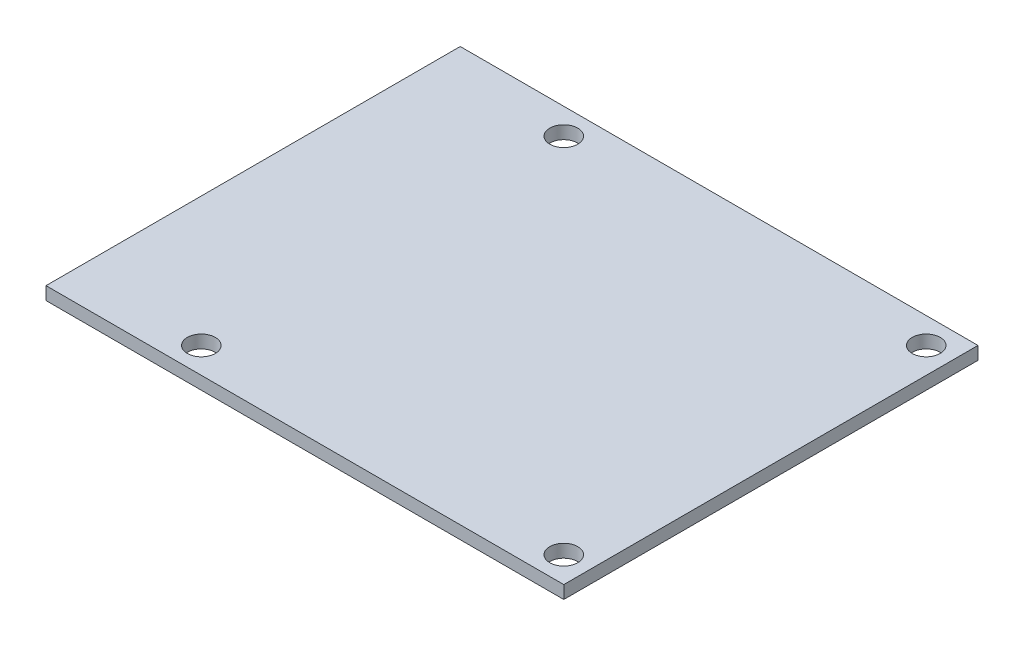
from build123d import *

# Parameters (mm, degrees)
SKETCH1_W           = 127
SKETCH1_H           = 101.6
BOSS_EXTRUDE1_DEPTH = 3.175
SKETCH2_R           = 3.429
CUT_EXTRUDE1_DEPTH  = 82.381635674


with BuildPart() as part:
    # Sketch1 → Boss-Extrude1 (new body)
    with BuildSketch(Plane(origin=(0, 0, 0), x_dir=(1, 0, 0), z_dir=(0, 1, 0))):
        Rectangle(SKETCH1_W, SKETCH1_H)
    extrude(amount=BOSS_EXTRUDE1_DEPTH)

    # Sketch2 → Cut-Extrude1 (cut, through all)
    with BuildSketch(Plane(origin=(0, 0, 0), x_dir=(-1, 0, 0), z_dir=(0, -1, 0))):
        with Locations(Location((-57.15, -44.45, 0), (0, 0, 90))):
            Circle(SKETCH2_R)
        with Locations(Location((31.75, -44.45, 0), (0, 0, 90))):
            Circle(SKETCH2_R)
        with Locations(Location((31.75, 44.45, 0), (0, 0, 90))):
            Circle(SKETCH2_R)
        with Locations(Location((-57.15, 44.45, 0), (0, 0, 90))):
            Circle(SKETCH2_R)
    extrude(amount=-CUT_EXTRUDE1_DEPTH, mode=Mode.SUBTRACT)


solid = part.part
